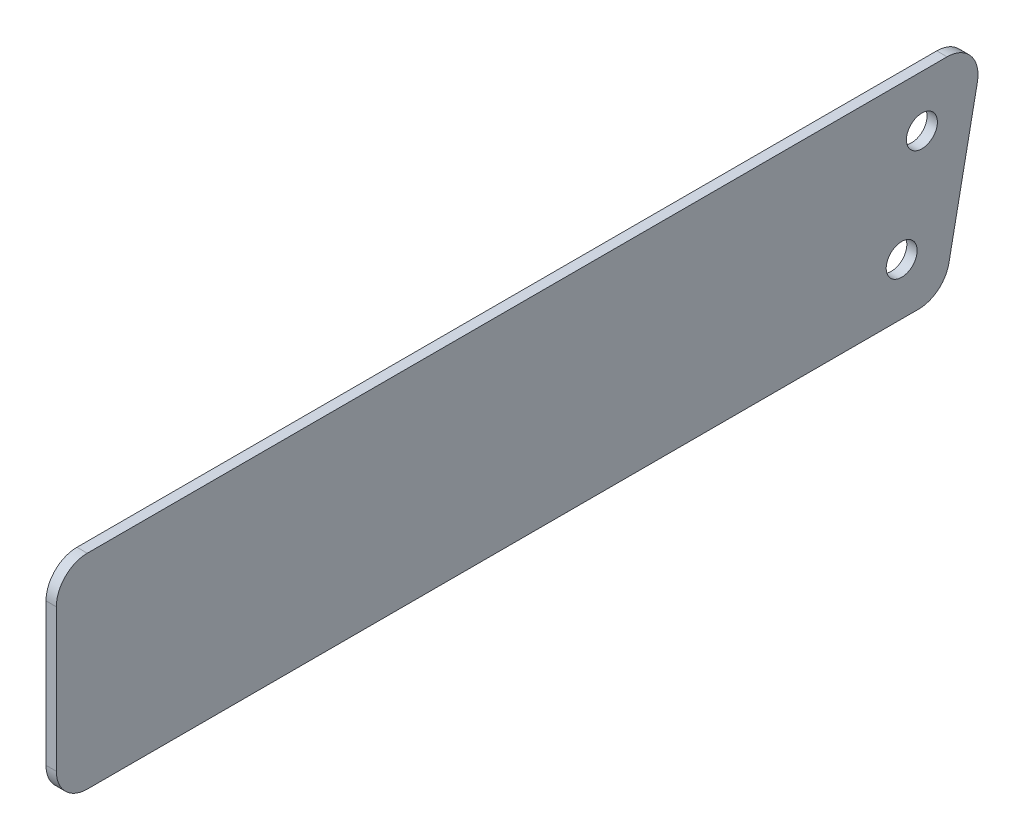
from build123d import *

# Parameters (mm, degrees)
SKETCH_1_R      = 1.5
EXTRUDE_1_DEPTH = 1
FILLET_1_R      = 3


with BuildPart() as part:
    # ｽｹｯﾁ1 → ﾎﾞｽ - 押し出し1 (new body)
    with BuildSketch(Plane(origin=(0, 0, 0), x_dir=(0, 0, -1), z_dir=(1, 0, 0))):
        Polygon((-45, 9.902902223), (-45, -9.902902223), (41.038814835, -9.902902223), (45, 9.902902223), align=None)
        with Locations((36.939800248, -4.902902223)):
            Circle(SKETCH_1_R, mode=Mode.SUBTRACT)
        with Locations((38.900973156, 4.902902223)):
            Circle(SKETCH_1_R, mode=Mode.SUBTRACT)
    extrude(amount=EXTRUDE_1_DEPTH)

    # ﾌｨﾚｯﾄ1
    fillet_1_edges = [part.edges().sort_by_distance(p)[0] for p in [
        (0.5, -9.902902223, -41.038814835),
        (0.5, -9.902902223, 45),
        (0.5, 9.902902223, 45),
        (0.5, 9.902902223, -45),
    ]]
    fillet(fillet_1_edges, radius=FILLET_1_R)


solid = part.part
